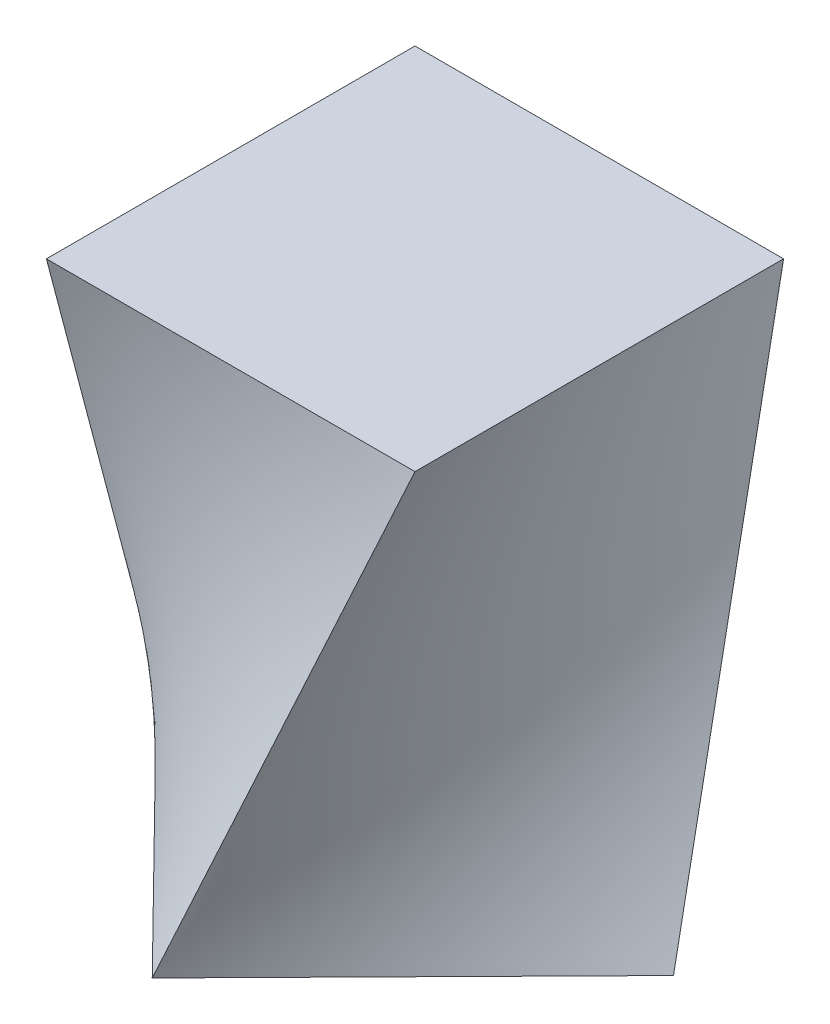
from build123d import *


with BuildPart() as part:
    # Sketch1 → Loft1 section 0
    with BuildSketch(Plane(origin=(0, 0, 0), x_dir=(1, 0, 0), z_dir=(0, 1, 0))):
        with BuildLine():
            Line((-42.077235956, 0), (0, -42.772727459))
            Line((0, -42.772727459), (42.077235956, 0))
            Line((42.077235956, 0), (0, 42.772727459))
            Line((0, 42.772727459), (-42.077235956, 0))
        make_face()
    # Sketch2 → Loft1 section 1
    with BuildSketch(Plane(origin=(0, 80, 0), x_dir=(1, 0, 0), z_dir=(0, 1, 0))):
        with BuildLine():
            Line((-30, -30), (30, -30))
            Line((30, -30), (30, 30))
            Line((30, 30), (-30, 30))
            Line((-30, 30), (-30, -30))
        make_face()
    loft()


solid = part.part
